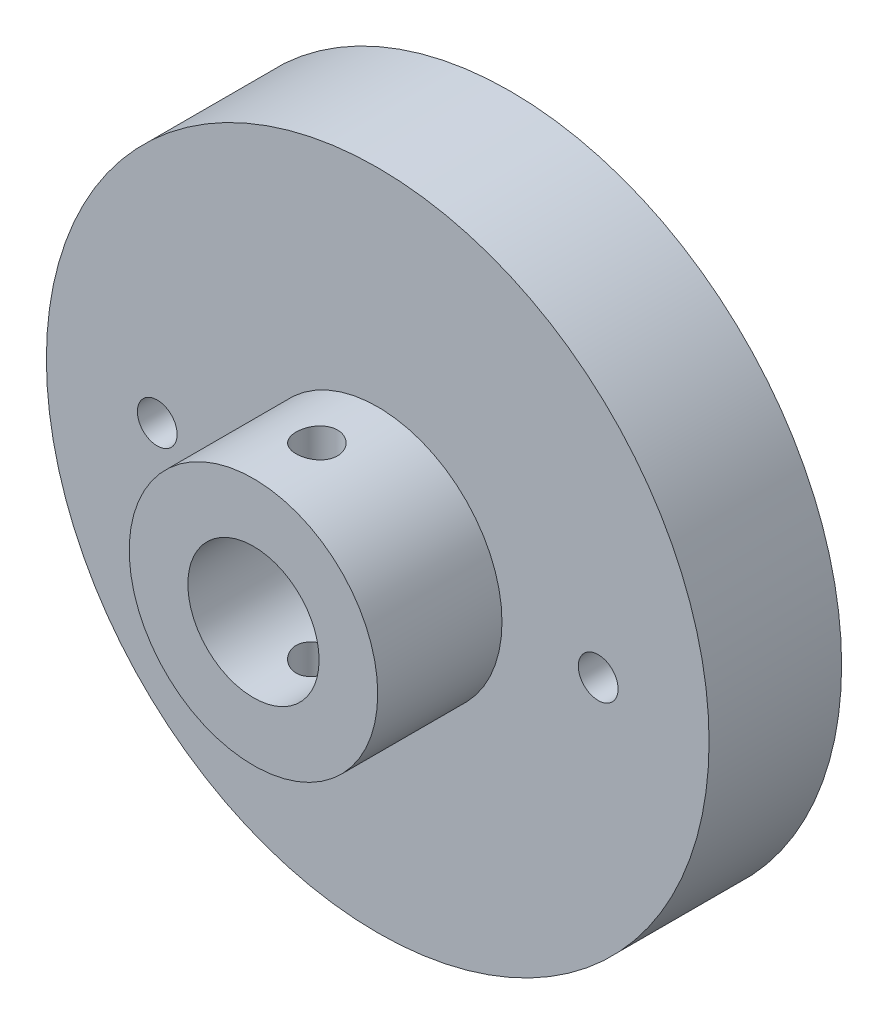
from build123d import *

# Parameters (mm, degrees)
SKETCH1_R           = 12.7
BOSS_EXTRUDE1_DEPTH = 5.08
SKETCH2_R           = 0.762
CUT_EXTRUDE1_DEPTH  = 19.66511184
SKETCH3_R           = 4.7625
BOSS_EXTRUDE2_DEPTH = 4.7625
SKETCH4_R           = 2.5146
CUT_EXTRUDE2_DEPTH  = 21.480595847
SKETCH5_R           = 0.79375
CUT_EXTRUDE3_DEPTH  = 24.964415416


with BuildPart() as part:
    # Sketch1 → Boss-Extrude1 (new body)
    with BuildSketch(Plane.XY):
        Circle(SKETCH1_R)
    extrude(amount=BOSS_EXTRUDE1_DEPTH)

    # Sketch2 → Cut-Extrude1 (cut, through all)
    with BuildSketch(Plane.XY.offset(5.08)):
        with Locations((-8.45058, 0)):
            Circle(SKETCH2_R)
        with Locations((8.45058, 0)):
            Circle(SKETCH2_R)
    extrude(amount=-CUT_EXTRUDE1_DEPTH, mode=Mode.SUBTRACT)

    # Sketch3 → Boss-Extrude2 (add)
    with BuildSketch(Plane.XY.offset(5.08)):
        with Locations(Location((0, 0, 0), (0, 0, 180))):
            Circle(SKETCH3_R)
    extrude(amount=BOSS_EXTRUDE2_DEPTH)

    # Sketch4 → Cut-Extrude2 (cut, through all)
    with BuildSketch(Plane.XY.offset(9.8425)):
        Circle(SKETCH4_R)
    extrude(amount=-CUT_EXTRUDE2_DEPTH, mode=Mode.SUBTRACT)

    # Sketch5 → Cut-Extrude3 (cut, through all)
    with BuildSketch(Plane(origin=(0, 5.08, 0), x_dir=(1, 0, 0), z_dir=(0, 1, 0))):
        with Locations(Location((0, -7.413542721, 0), (0, 0, 270))):
            Circle(SKETCH5_R)
    extrude(amount=-CUT_EXTRUDE3_DEPTH, mode=Mode.SUBTRACT)


solid = part.part
